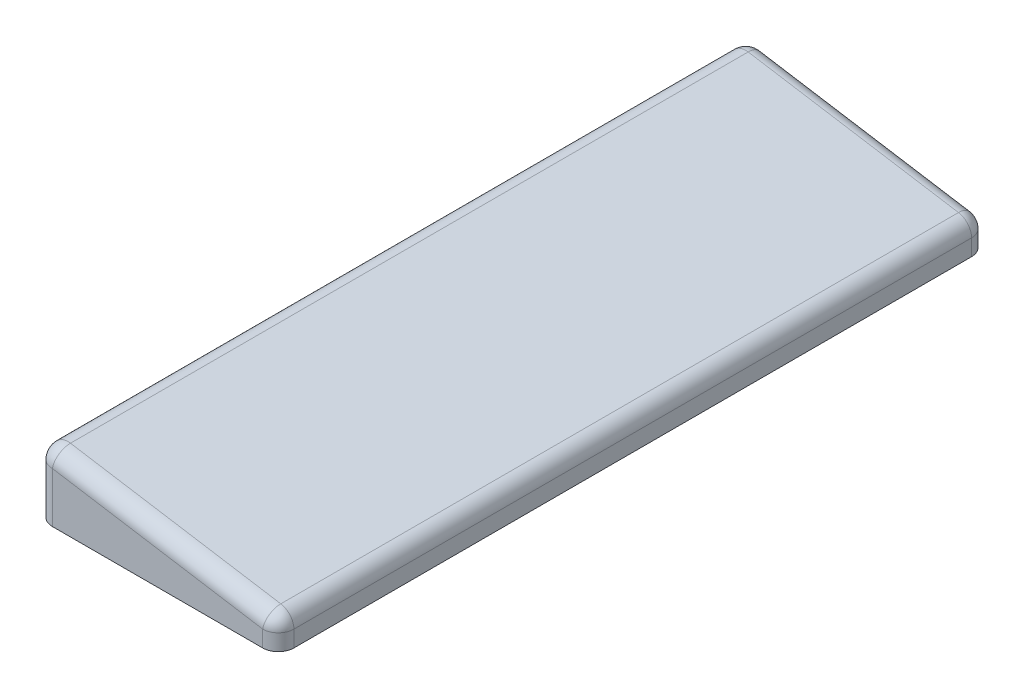
from build123d import *

# Parameters (mm, degrees)
BOSS_EXTRUDE1_DEPTH = 455
FILLET1_R           = 10
FILLET2_R           = 10
FILLET3_R           = 10
FILLET4_R           = 10


with BuildPart() as part:
    # Sketch1 → Boss-Extrude1 (new body)
    with BuildSketch(Plane.XY):
        Polygon((0, 0), (155, 0), (155, 19), (0, 44), align=None)
    extrude(amount=-BOSS_EXTRUDE1_DEPTH)

    # Fillet1
    fillet1_edges = [part.edges().sort_by_distance(p)[0] for p in [
        (155, 19, -227.5),
    ]]
    fillet(fillet1_edges, radius=FILLET1_R)

    # Fillet2
    fillet2_edges = [part.edges().sort_by_distance(p)[0] for p in [
        (0, 44, -227.5),
    ]]
    fillet(fillet2_edges, radius=FILLET2_R)

    # Fillet3
    fillet3_edges = [part.edges().sort_by_distance(p)[0] for p in [
        (79.092324388, 31.243173486, 0),
        (152.613253046, 16.967366458, 0),
        (0, 16.128929526, 0),
        (3.516299046, 39.871112099, 0),
        (155, 5.241832752, 0),
    ]]
    fillet(fillet3_edges, radius=FILLET3_R)

    # Fillet4
    fillet4_edges = [part.edges().sort_by_distance(p)[0] for p in [
        (155, 5.241832752, -455),
        (79.092324388, 31.243173486, -455),
        (152.613253046, 16.967366458, -455),
        (0, 16.128929526, -455),
        (3.516299046, 39.871112099, -455),
    ]]
    fillet(fillet4_edges, radius=FILLET4_R)


solid = part.part
